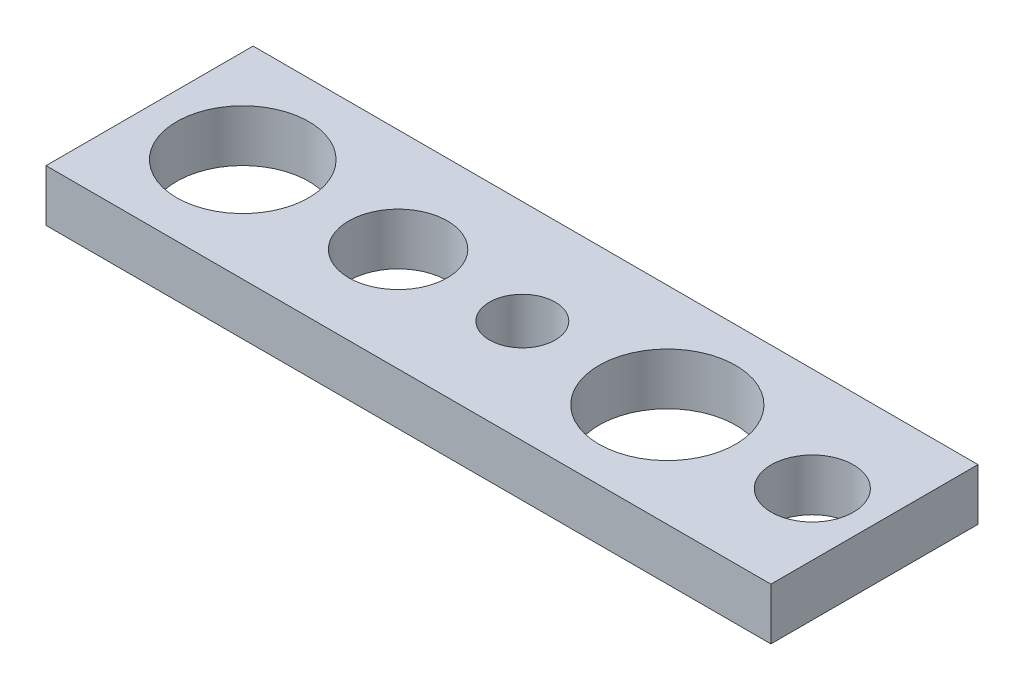
from build123d import *

# Parameters (mm, degrees)
ESQUISSE1_W             = 70
ESQUISSE1_H             = 20
BOSS_EXTRU_1_DEPTH      = 5
ESQUISSE2_R             = 6.375
ESQUISSE2_R_2           = 4.7625
ESQUISSE2_R_3           = 3.175
ESQUISSE2_R_4           = 6.6
ESQUISSE2_R_5           = 3.96875
ENL_V_MAT_EXTRU_1_DEPTH = 57.034073255


with BuildPart() as part:
    # Esquisse1 → Boss.-Extru.1 (new body)
    with BuildSketch(Plane(origin=(0, 0, 0), x_dir=(1, 0, 0), z_dir=(0, 1, 0))):
        with Locations((19.444444444, -2.272727273)):
            Rectangle(ESQUISSE1_W, ESQUISSE1_H)
    extrude(amount=BOSS_EXTRU_1_DEPTH)

    # Esquisse2 → Enlèv. mat.-Extru.1 (cut, through all)
    with BuildSketch(Plane(origin=(0, 5, 0), x_dir=(1, 0, 0), z_dir=(0, 1, 0))):
        with Locations(Location((-6.555555556, -2.272727273, 0), (0, 0, 270))):
            Circle(ESQUISSE2_R)
        with Locations(Location((8.444444444, -2.272727273, 0), (0, 0, 270))):
            Circle(ESQUISSE2_R_2)
        with Locations(Location((20.444444444, -2.272727273, 0), (0, 0, 270))):
            Circle(ESQUISSE2_R_3)
        with Locations(Location((34.444444444, -2.272727273, 0), (0, 0, 270))):
            Circle(ESQUISSE2_R_4)
        with Locations(Location((48.444444444, -2.272727273, 0), (0, 0, 270))):
            Circle(ESQUISSE2_R_5)
    extrude(amount=-ENL_V_MAT_EXTRU_1_DEPTH, mode=Mode.SUBTRACT)


solid = part.part
